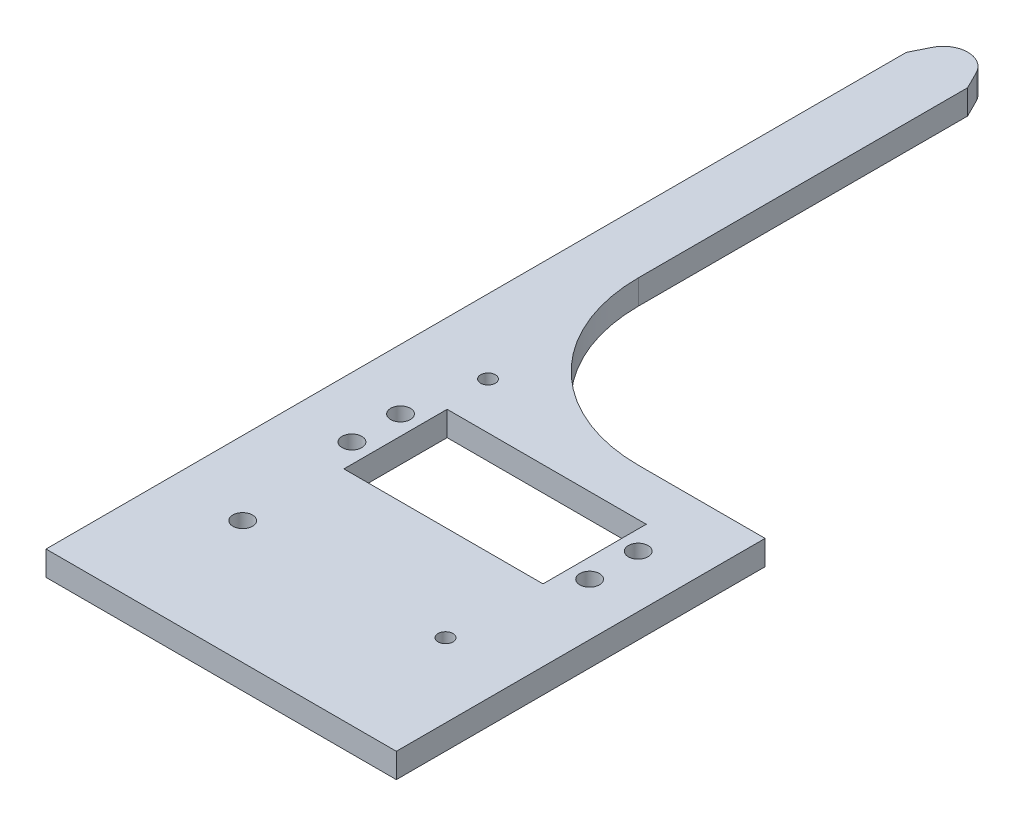
from build123d import *

# Parameters (mm, degrees)
BOSS_EXTRUDE1_DEPTH = 2.5
SKETCH2_W           = 39
SKETCH2_H           = 19
CUT_EXTRUDE2_DEPTH  = 118.286651401
SKETCH6_R           = 1.5
SKETCH6_R_2         = 2
CUT_EXTRUDE11_DEPTH = 118.286651401
SKETCH8_W           = 39.164697568
SKETCH8_H           = 2
CUT_EXTRUDE12_DEPTH = 10
SKETCH9_W           = 40.5
SKETCH9_H           = 21
CUT_EXTRUDE14_DEPTH = 10
SKETCH10_R          = 2
CUT_EXTRUDE16_DEPTH = 10
SKETCH14_W          = 61.515702129
SKETCH14_H          = 51.963385976
CUT_EXTRUDE19_DEPTH = 10
FILLET4_R           = 5


with BuildPart() as part:
    # Sketch1 → Boss-Extrude1 (new, symmetric)
    with BuildSketch(Plane(origin=(0, 0, 0), x_dir=(1, 0, 0), z_dir=(0, 1, 0))):
        with BuildLine():
            Line((-45.466733516, 13.267794591), (-45.466733516, -107.999697871))
            Line((-45.466733516, -107.999697871), (25.786244138, -107.999697871))
            Line((25.786244138, -107.999697871), (25.786244138, -33))
            Line((25.786244138, -33), (0, -33))
            ThreePointArc((0, -33), (-23.334523779, -23.334523779), (-33, 0))
            Line((-33, 0), (-33, 13.267794591))
            Line((-33, 13.267794591), (-30.215321059, 13.267794591))
            ThreePointArc((-30.215321059, 13.267794591), (-18.043874009, 27.630030958), (0, 33))
            Line((0, 33), (0, 48))
            ThreePointArc((0, 48), (-17.760506671, 44.593322401), (-33, 34.856850116))
            Line((-33, 34.856850116), (-33, 66.974298245))
            Line((-33, 66.974298245), (-39.23, 79.434298245))
            Line((-39.23, 79.434298245), (-45.46, 66.974298245))
            Line((-45.46, 66.974298245), (-45.46, 13.267794591))
            Line((-45.46, 13.267794591), (-45.466733516, 13.267794591))
        make_face()
        with BuildLine():
            ThreePointArc((0, -48), (-3.55792227, -47.867955765), (-7.096269411, -47.472549547))
            Line((-7.096269411, -47.472549547), (0, -47.472549547))
            Line((0, -47.472549547), (0, -48))
        make_face(mode=Mode.SUBTRACT)
    extrude(amount=BOSS_EXTRUDE1_DEPTH, both=True)

    # Sketch2 → Cut-Extrude2 (cut, through all)
    with BuildSketch(Plane(origin=(0, 2.5, 0), x_dir=(1, 0, 0), z_dir=(0, 1, 0))):
        with Locations((-9.786245396, -52.095481266)):
            Rectangle(SKETCH2_W, SKETCH2_H)
    extrude(amount=-CUT_EXTRUDE2_DEPTH, mode=Mode.SUBTRACT)

    # Sketch6 → Cut-Extrude11 (cut, through all)
    with BuildSketch(Plane(origin=(0, 2.5, 0), x_dir=(1, 0, 0), z_dir=(0, 1, 0))):
        with Locations(Location((10.786244138, -82.999697871, 0), (0, 0, 270))):
            Circle(SKETCH6_R)
        with Locations(Location((-30.466733516, -82.999697871, 0), (0, 0, 270))):
            Circle(SKETCH6_R_2)
        with Locations(Location((-30.466733516, -33.095481266, 0), (0, 0, 270))):
            Circle(SKETCH6_R)
    extrude(amount=-CUT_EXTRUDE11_DEPTH, mode=Mode.SUBTRACT)

    # Sketch8 → Cut-Extrude12 (cut)
    with BuildSketch(Plane(origin=(0, 2.5, 0), x_dir=(1, 0, 0), z_dir=(0, 1, 0))):
        with Locations((-9.703896612, -62.595481266)):
            Rectangle(SKETCH8_W, SKETCH8_H)
    extrude(amount=-CUT_EXTRUDE12_DEPTH, mode=Mode.SUBTRACT)

    # Sketch9 → Cut-Extrude14 (cut)
    with BuildSketch(Plane(origin=(0, 2.5, 0), x_dir=(1, 0, 0), z_dir=(0, 1, 0))):
        with Locations((-9.036245396, -53.095481266)):
            Rectangle(SKETCH9_W, SKETCH9_H)
    extrude(amount=-CUT_EXTRUDE14_DEPTH, mode=Mode.SUBTRACT)

    # Sketch10 → Cut-Extrude16 (cut)
    with BuildSketch(Plane(origin=(0, 2.5, 0), x_dir=(1, 0, 0), z_dir=(0, 1, 0))):
        with Locations(Location((-33.206245396, -48.155481266, 0), (0, 0, 270))):
            Circle(SKETCH10_R)
        with Locations(Location((-33.206245396, -58.035481266, 0), (0, 0, 270))):
            Circle(SKETCH10_R)
        with Locations(Location((15.133754604, -58.035481266, 0), (0, 0, 270))):
            Circle(SKETCH10_R)
        with Locations(Location((15.133754604, -48.155481266, 0), (0, 0, 270))):
            Circle(SKETCH10_R)
    extrude(amount=-CUT_EXTRUDE16_DEPTH, mode=Mode.SUBTRACT)

    # Sketch14 → Cut-Extrude19 (cut)
    with BuildSketch(Plane(origin=(0, 2.5, 0), x_dir=(1, 0, 0), z_dir=(0, 1, 0))):
        with Locations((-2.242148935, 25.981692988)):
            Rectangle(SKETCH14_W, SKETCH14_H)
    extrude(amount=-CUT_EXTRUDE19_DEPTH, mode=Mode.SUBTRACT)

    # Fillet4
    fillet4_edges = [part.edges().sort_by_distance(p)[0] for p in [
        (-39.23, 0, -79.434298245),
    ]]
    fillet(fillet4_edges, radius=FILLET4_R)


solid = part.part
